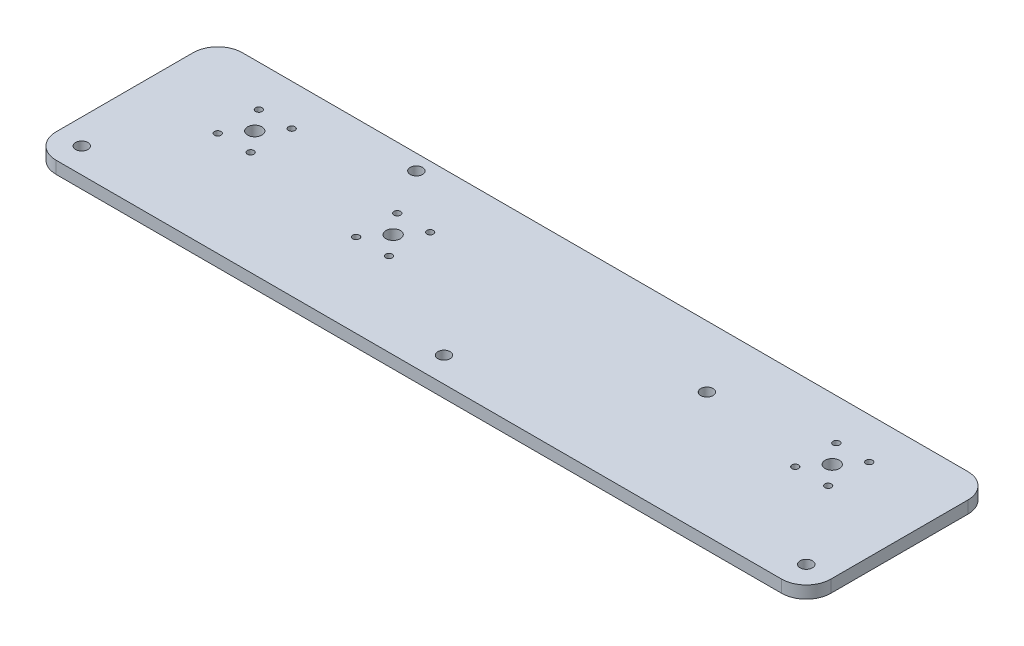
from build123d import *

# Parameters (mm, degrees)
ESBO_O1_R                = 3.5
ESBO_O1_R_2              = 3
ESBO_O1_R_3              = 1.6
RESSALTO_EXTRUS_O1_DEPTH = 6


with BuildPart() as part:
    # Esboço1 → Ressalto-extrusão1 (new body)
    with BuildSketch(Plane(origin=(0, 0, 0), x_dir=(1, 0, 0), z_dir=(0, 1, 0))):
        with BuildLine():
            Line((188.965018959, -38.648697641), (188.965018959, 28))
            ThreePointArc((188.965018959, 28), (185.450300333, 36.485281374), (176.965018959, 40))
            Line((176.965018959, 40), (-176.090826953, 40))
            ThreePointArc((-176.090826953, 40), (-184.576108327, 36.485281374), (-188.090826953, 28))
            Line((-188.090826953, 28), (-188.090826953, -38.648697641))
            ThreePointArc((-188.090826953, -38.648697641), (-184.576108327, -47.133979015), (-176.090826953, -50.648697641))
            Line((-176.090826953, -50.648697641), (176.965018959, -50.648697641))
            ThreePointArc((176.965018959, -50.648697641), (185.450300333, -47.133979015), (188.965018959, -38.648697641))
        make_face()
        with Locations(Location((-62.734509176, 0, 0), (0, 0, 90))):
            Circle(ESBO_O1_R, mode=Mode.SUBTRACT)
        with Locations(Location((176.748138959, -38.431817641, 0), (0, 0, 90))):
            Circle(ESBO_O1_R_2, mode=Mode.SUBTRACT)
        with Locations(Location((0.437096003, -38.431817641, 0), (0, 0, 90))):
            Circle(ESBO_O1_R_2, mode=Mode.SUBTRACT)
        with Locations(Location((79.965018959, 10, 0), (0, 0, 90))):
            Circle(ESBO_O1_R_2, mode=Mode.SUBTRACT)
        with Locations(Location((-140.090826953, 10, 0), (0, 0, 90))):
            Circle(ESBO_O1_R, mode=Mode.SUBTRACT)
        with Locations(Location((-148.090826953, 0, 0), (0, 0, 270))):
            Circle(ESBO_O1_R_3, mode=Mode.SUBTRACT)
        with Locations(Location((-132.090826953, 0, 0), (0, 0, 270))):
            Circle(ESBO_O1_R_3, mode=Mode.SUBTRACT)
        with Locations(Location((-132.090826953, 20, 0), (0, 0, 270))):
            Circle(ESBO_O1_R_3, mode=Mode.SUBTRACT)
        with Locations(Location((-148.090826953, 20, 0), (0, 0, 270))):
            Circle(ESBO_O1_R_3, mode=Mode.SUBTRACT)
        with Locations(Location((-70.734509176, -10, 0), (0, 0, 270))):
            Circle(ESBO_O1_R_3, mode=Mode.SUBTRACT)
        with Locations(Location((-70.734509176, 10, 0), (0, 0, 270))):
            Circle(ESBO_O1_R_3, mode=Mode.SUBTRACT)
        with Locations(Location((-54.734509176, 10, 0), (0, 0, 270))):
            Circle(ESBO_O1_R_3, mode=Mode.SUBTRACT)
        with Locations(Location((-54.734509176, -10, 0), (0, 0, 270))):
            Circle(ESBO_O1_R_3, mode=Mode.SUBTRACT)
        with Locations(Location((-83.930342624, 32.5, 0), (0, 0, 90))):
            Circle(ESBO_O1_R_2, mode=Mode.SUBTRACT)
        with Locations(Location((-175.873946953, -38.431817641, 0), (0, 0, 90))):
            Circle(ESBO_O1_R_2, mode=Mode.SUBTRACT)
        with Locations(Location((140.965018959, 10, 0), (0, 0, 90))):
            Circle(ESBO_O1_R, mode=Mode.SUBTRACT)
        with Locations(Location((148.965018959, 0, 0), (0, 0, 90))):
            Circle(ESBO_O1_R_3, mode=Mode.SUBTRACT)
        with Locations(Location((148.965018959, 20, 0), (0, 0, 90))):
            Circle(ESBO_O1_R_3, mode=Mode.SUBTRACT)
        with Locations(Location((132.965018959, 0, 0), (0, 0, 90))):
            Circle(ESBO_O1_R_3, mode=Mode.SUBTRACT)
        with Locations(Location((132.965018959, 20, 0), (0, 0, 90))):
            Circle(ESBO_O1_R_3, mode=Mode.SUBTRACT)
    extrude(amount=-RESSALTO_EXTRUS_O1_DEPTH)


solid = part.part
